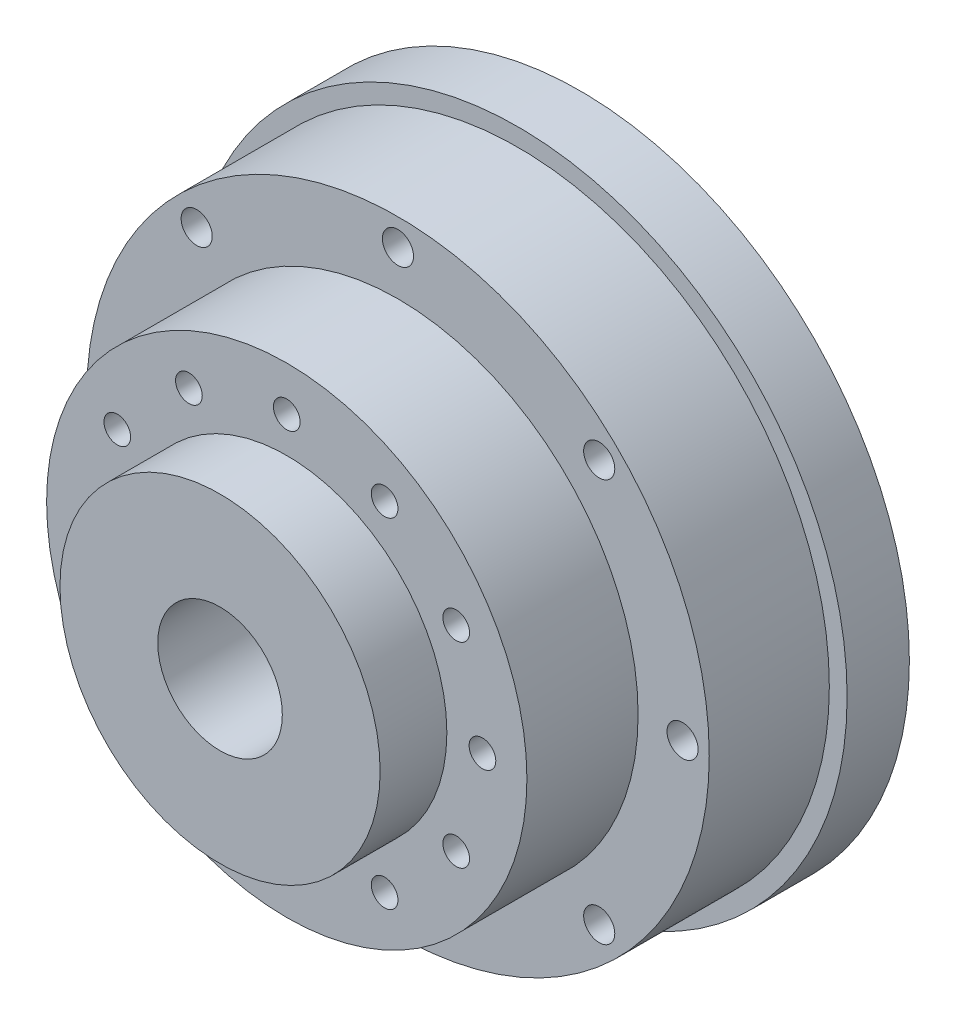
from build123d import *

# Parameters (mm, degrees)
SKETCH_1_R          = 37
EXTRUDE_1_DEPTH     = 7
SKETCH_2_R          = 35
EXTRUDE_2_DEPTH     = 13.5
SKETCH_3_R          = 27
EXTRUDE_3_DEPTH     = 12.5
SKETCH_4_R          = 18
EXTRUDE_4_DEPTH     = 7.5
EXTRUDE_START       = 5.5
SKETCH_5_R          = 18
EXTRUDE_5_DEPTH     = 5.5
SKETCH_6_R          = 10
EXTRUDE_6_DEPTH     = 6.5
SKETCH_7_R          = 7
CUT_EXTRUDE_1_DEPTH = 52.5
SKETCH_8_R          = 1.75
CUT_EXTRUDE_2_DEPTH = 20.5
SKETCH_9_R          = 1.5
CUT_EXTRUDE_3_DEPTH = 10


with BuildPart() as part:
    # Эскиз1 → Бобышка-Вытянуть1 (new body)
    with BuildSketch(Plane.XY):
        Circle(SKETCH_1_R)
    extrude(amount=EXTRUDE_1_DEPTH)

    # Эскиз2 → Бобышка-Вытянуть2 (add)
    with BuildSketch(Plane.XY.offset(7)):
        Circle(SKETCH_2_R)
    extrude(amount=EXTRUDE_2_DEPTH)

    # Эскиз3 → Бобышка-Вытянуть3 (add)
    with BuildSketch(Plane.XY.offset(20.5)):
        Circle(SKETCH_3_R)
    extrude(amount=EXTRUDE_3_DEPTH)

    # Эскиз4 → Бобышка-Вытянуть4 (add)
    with BuildSketch(Plane.XY.offset(33)):
        Circle(SKETCH_4_R)
    extrude(amount=EXTRUDE_4_DEPTH)

    # Эскиз5 → Бобышка-Вытянуть5 (add)
    with BuildSketch(Plane(origin=(0, 0, 0), x_dir=(-1, 0, 0), z_dir=(0, 0, -1)).offset(EXTRUDE_START)):
        with Locations(Location((0, 0, 0), (0, 0, 180))):
            Circle(SKETCH_5_R)
    extrude(amount=-EXTRUDE_5_DEPTH)

    # Эскиз6 → Бобышка-Вытянуть6 (add)
    with BuildSketch(Plane(origin=(0, 0, -5.5), x_dir=(-1, 0, 0), z_dir=(0, 0, -1))):
        with Locations(Location((0, 0, 0), (0, 0, 180))):
            Circle(SKETCH_6_R)
    extrude(amount=EXTRUDE_6_DEPTH)

    # Эскиз7 → Вырез-Вытянуть1 (cut)
    with BuildSketch(Plane(origin=(0, 0, -12), x_dir=(-1, 0, 0), z_dir=(0, 0, -1))):
        Circle(SKETCH_7_R)
    extrude(amount=-CUT_EXTRUDE_1_DEPTH, mode=Mode.SUBTRACT)

    # Эскиз8 → Вырез-Вытянуть2 (cut)
    with BuildSketch(Plane.XY.offset(20.5)):
        with Locations((0, 32)):
            Circle(SKETCH_8_R)
        with Locations((22.627416998, 22.627416998)):
            Circle(SKETCH_8_R)
        with Locations((32, 0)):
            Circle(SKETCH_8_R)
        with Locations((22.627416998, -22.627416998)):
            Circle(SKETCH_8_R)
        with Locations((0, -32)):
            Circle(SKETCH_8_R)
        with Locations((-22.627416998, -22.627416998)):
            Circle(SKETCH_8_R)
        with Locations((-32, 0)):
            Circle(SKETCH_8_R)
        with Locations((-22.627416998, 22.627416998)):
            Circle(SKETCH_8_R)
    extrude(amount=-CUT_EXTRUDE_2_DEPTH, mode=Mode.SUBTRACT)

    # Эскиз9 → Вырез-Вытянуть3 (cut)
    with BuildSketch(Plane.XY.offset(33)):
        with Locations((0, 22)):
            Circle(SKETCH_9_R)
        with Locations((11, 19.052558883)):
            Circle(SKETCH_9_R)
        with Locations((19.052558883, 11)):
            Circle(SKETCH_9_R)
        with Locations((22, 0)):
            Circle(SKETCH_9_R)
        with Locations((19.052558883, -11)):
            Circle(SKETCH_9_R)
        with Locations((11, -19.052558883)):
            Circle(SKETCH_9_R)
        with Locations((0, -22)):
            Circle(SKETCH_9_R)
        with Locations((-11, -19.052558883)):
            Circle(SKETCH_9_R)
        with Locations((-19.052558883, -11)):
            Circle(SKETCH_9_R)
        with Locations((-22, 0)):
            Circle(SKETCH_9_R)
        with Locations((-19.052558883, 11)):
            Circle(SKETCH_9_R)
        with Locations((-11, 19.052558883)):
            Circle(SKETCH_9_R)
    extrude(amount=-CUT_EXTRUDE_3_DEPTH, mode=Mode.SUBTRACT)


solid = part.part
